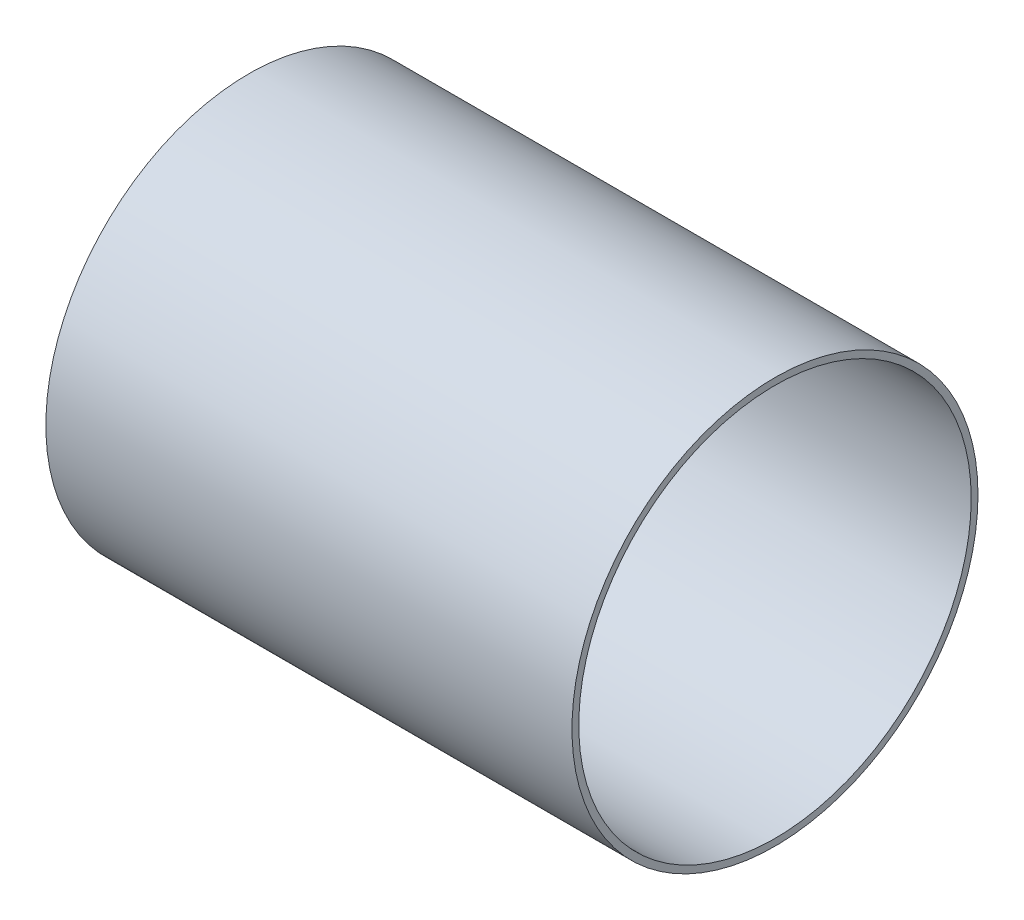
from build123d import *

# Parameters (mm, degrees)
ESBO_O1_R                = 10.765
ESBO_O1_R_2              = 10.405
RESSALTO_EXTRUS_O3_DEPTH = 27.9


with BuildPart() as part:
    # Esboço1 → Ressalto-extrusão3 (new body)
    with BuildSketch(Plane(origin=(0, 0, 0), x_dir=(0, 0, -1), z_dir=(1, 0, 0))):
        Circle(ESBO_O1_R)
        Circle(ESBO_O1_R_2, mode=Mode.SUBTRACT)
    extrude(amount=RESSALTO_EXTRUS_O3_DEPTH)


solid = part.part
